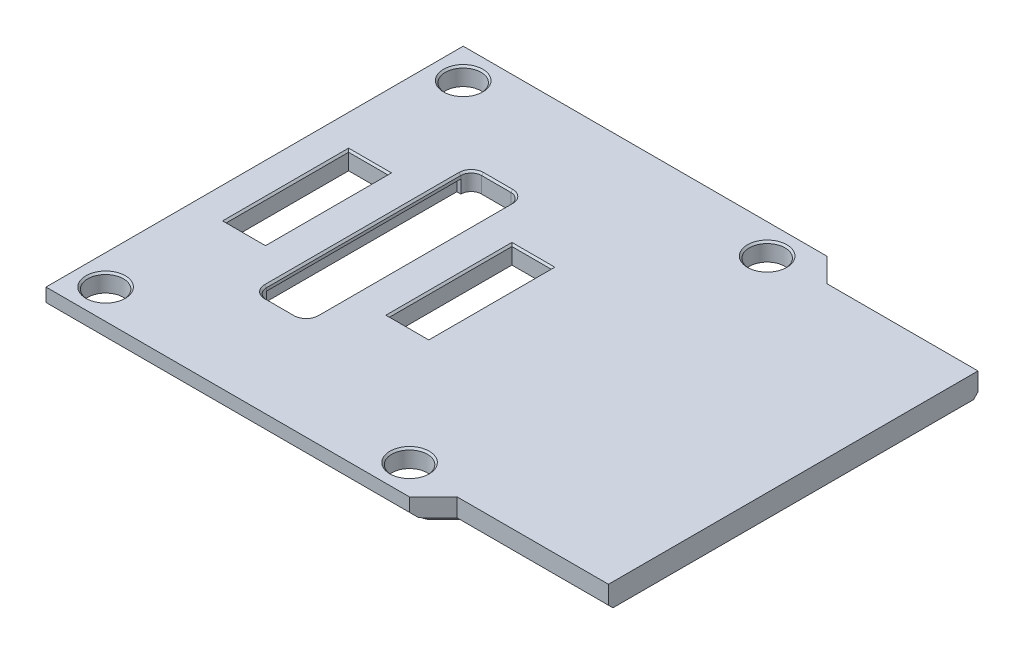
from build123d import *

# Parameters (mm, degrees)
SKETCH21_R          = 3
SKETCH21_W          = 6.6
SKETCH21_H          = 20.55
BOSS_EXTRUDE3_DEPTH = 3
BOSS_EXTRUDE2_DEPTH = 0.8
CUT_EXTRUDE1_DEPTH  = 2.2
CUT_EXTRUDE2_DEPTH  = 1
CHAMFER1_SIZE       = 0.3
CHAMFER2_SIZE       = 0.75


with BuildPart() as part:
    # Sketch21 → Boss-Extrude3 (new body)
    with BuildSketch(Plane(origin=(0, 0, 0), x_dir=(1, 0, 0), z_dir=(0, 1, 0))):
        Polygon((38.5, 35), (-22.5, 35), (-22.5, -35), (38.5, -35), (42.5, -31), (67.875, -31), (67.875, 31), (42.5, 31), align=None)
        with Locations(Location((-17.5, 30, 0), (0, 0, 270))):
            Circle(SKETCH21_R, mode=Mode.SUBTRACT)
        with Locations(Location((-17.5, -30, 0), (0, 0, 270))):
            Circle(SKETCH21_R, mode=Mode.SUBTRACT)
        with Locations(Location((33.5, -30, 0), (0, 0, 270))):
            Circle(SKETCH21_R, mode=Mode.SUBTRACT)
        with Locations(Location((33.5, 30, 0), (0, 0, 270))):
            Circle(SKETCH21_R, mode=Mode.SUBTRACT)
        with Locations((-13.7, 0)):
            Rectangle(SKETCH21_W, SKETCH21_H, mode=Mode.SUBTRACT)
        with BuildLine():
            Line((-4.21, 16.3), (-4.21, -16.3))
            ThreePointArc((-4.21, -16.3), (-3.697436867, -17.537436867), (-2.46, -18.05))
            Line((-2.46, -18.05), (2.46, -18.05))
            ThreePointArc((2.46, -18.05), (3.697436867, -17.537436867), (4.21, -16.3))
            Line((4.21, -16.3), (4.21, 16.3))
            ThreePointArc((4.21, 16.3), (3.697436867, 17.537436867), (2.46, 18.05))
            Line((2.46, 18.05), (-2.46, 18.05))
            ThreePointArc((-2.46, 18.05), (-3.697436867, 17.537436867), (-4.21, 16.3))
        make_face(mode=Mode.SUBTRACT)
        with Locations((13.7, 0)):
            Rectangle(SKETCH21_W, SKETCH21_H, mode=Mode.SUBTRACT)
    extrude(amount=BOSS_EXTRUDE3_DEPTH)

    # Sketch28 → Boss-Extrude2 (add)
    with BuildSketch(Plane.XZ):
        Polygon((39.5, 34), (39.5, -34), (42.5, -31), (67.875, -31), (67.875, 31), (42.5, 31), align=None)
    extrude(amount=BOSS_EXTRUDE2_DEPTH)

    # Sketch29 → Cut-Extrude1 (cut)
    with BuildSketch(Plane.XZ):
        Polygon((-4.21, 16.3), (-4.875, 16.3), (-4.875, -16.3), (-4.21, -16.3), (4.21, -16.3), (4.875, -16.3), (4.875, 16.3), (4.21, 16.3), align=None)
    extrude(amount=-CUT_EXTRUDE1_DEPTH, mode=Mode.SUBTRACT)

    # Sketch30 → Cut-Extrude2 (cut)
    # profile 1 of 4: a face of its own
    with BuildSketch(Plane.XZ):
        Polygon((30, -6.084415584), (30, -7.123376623), (23.194805195, -7.123376623), (30, -9.358766234), (30, -10.290584416), (23.194805195, -12.525974026), (30, -12.525974026), (30, -13.564935065), (22, -13.564935065), (22, -11.939935065), (28.668831169, -9.829545455), (22, -7.709415584), (22, -6.084415584), align=None)
    # profile 2 of 4: a face of its own
    with BuildSketch(Plane.XZ):
        with BuildLine():
            add(Edge.make_bspline(
                [(30.103896104, -2.298701299), (30.103067309, -2.395623244), (30.101458149, -2.583803562), (30.077120757, -2.856806977), (30.043441513, -3.112684332), (29.990720477, -3.349454628), (29.92681865, -3.569556735), (29.84494459, -3.770560491), (29.751676383, -3.9562646), (29.640184851, -4.121871579), (29.516615752, -4.272075178), (29.375879847, -4.401668661), (29.221972567, -4.515692158), (29.052257996, -4.609156913), (28.868514081, -4.686592109), (28.670085387, -4.743928609), (28.457107647, -4.785605452), (28.309709631, -4.797462408), (28.233766234, -4.803571429)],
                knots=[0, 0, 0, 0, 1.318794478, 2.560526035, 3.728243692, 4.829167506, 5.859211314, 6.844017696, 7.77958115, 8.682536498, 9.55583357, 10.420985288, 11.279874663, 12.156984126, 13.05163966, 13.988564904, 14.963654886, 16, 16, 16, 16], degree=3))
            Line((28.233766234, -4.803571429), (28.233766234, -3.76461039))
            add(Edge.make_bspline(
                [(28.233766234, -3.76461039), (28.276082816, -3.763564761), (28.357947694, -3.761541907), (28.476134337, -3.740166384), (28.586751637, -3.712672627), (28.688349357, -3.67036585), (28.783864525, -3.621500377), (28.868666466, -3.555998852), (28.946860594, -3.482137003), (29.015350514, -3.395594265), (29.078413582, -3.299861025), (29.128391442, -3.189971645), (29.17548457, -3.07144951), (29.209220227, -2.940779669), (29.240159157, -2.800318747), (29.257500765, -2.647495072), (29.271994968, -2.484042329), (29.272478757, -2.371250975), (29.272727273, -2.313311688)],
                knots=[0, 0, 0, 0, 1.000573209, 1.935690443, 2.836843993, 3.693268586, 4.535782358, 5.368499125, 6.220215677, 7.076544447, 7.975601122, 8.926814499, 9.928453325, 10.991382637, 12.117004715, 13.331014315, 14.628980654, 16, 16, 16, 16], degree=3))
            add(Edge.make_bspline(
                [(29.272727273, -2.313311688), (29.272477286, -2.261323175), (29.271992064, -2.160413873), (29.25754424, -2.01369465), (29.239472891, -1.876258483), (29.21132631, -1.748275466), (29.176555316, -1.630075024), (29.131923796, -1.521611339), (29.080501402, -1.422166793), (29.001941506, -1.306296479), (28.891278773, -1.182718379), (28.73659228, -1.072587187), (28.562614518, -1.00468464), (28.440535545, -0.997283039), (28.378246753, -0.993506494)],
                knots=[0, 0, 0, 0, 1.049722362, 2.037502948, 2.975957546, 3.848689641, 4.682196446, 5.461765277, 6.214820971, 6.939488855, 8.285974658, 9.541612251, 10.745648019, 12, 12, 12, 12], degree=3))
            add(Edge.make_bspline(
                [(28.378246753, -0.993506494), (28.346763417, -0.994183282), (28.285509435, -0.995500043), (28.198094752, -1.013038493), (28.116989153, -1.036078954), (28.043895516, -1.073277175), (27.978132386, -1.120152847), (27.91781187, -1.175968403), (27.867975971, -1.243948686), (27.822461309, -1.322779364), (27.783044583, -1.418968765), (27.736245211, -1.532239323), (27.690729471, -1.668941517), (27.640192756, -1.826342557), (27.586743359, -2.005529733), (27.52981461, -2.206135721), (27.472099938, -2.429578583), (27.410484723, -2.667825675), (27.348547139, -2.908916775), (27.281606559, -3.138344652), (27.213843382, -3.35068402), (27.144538665, -3.546605107), (27.071027512, -3.724150567), (26.999273376, -3.886230737), (26.921988655, -4.029162978), (26.844897165, -4.158210405), (26.757806858, -4.271639817), (26.655650322, -4.368805026), (26.538272332, -4.449974022), (26.405573224, -4.515399248), (26.259022178, -4.567101625), (26.096859779, -4.604654298), (25.919870357, -4.624614358), (25.797123614, -4.628080852), (25.733766234, -4.62987013)],
                knots=[0, 0, 0, 0, 0.609469888, 1.185784659, 1.72354831, 2.239788445, 2.766795736, 3.28643782, 3.825837257, 4.394650866, 5.047817349, 5.838989728, 6.771546224, 7.840191231, 9.04536596, 10.397473415, 11.883969141, 13.520573579, 15.169980156, 16.710930355, 18.154580726, 19.492276644, 20.739482987, 21.88068629, 22.927624582, 23.888735019, 24.79347993, 25.691627909, 26.611521855, 27.550140283, 28.552530272, 29.619112255, 30.771072804, 32, 32, 32, 32], degree=3))
            add(Edge.make_bspline(
                [(25.733766234, -4.62987013), (25.67520802, -4.627970482), (25.560134212, -4.62423745), (25.391367911, -4.595537471), (25.230466456, -4.550698077), (25.077097455, -4.486528081), (24.932327589, -4.402583067), (24.793763605, -4.302331737), (24.665049855, -4.181655436), (24.543482, -4.046039193), (24.43312437, -3.894260688), (24.339684079, -3.727132066), (24.257615927, -3.549505201), (24.190985373, -3.359321562), (24.141623211, -3.156271887), (24.103560771, -2.942230454), (24.083220864, -2.715216877), (24.079718791, -2.560100694), (24.077922078, -2.480519481)],
                knots=[0, 0, 0, 0, 0.925490325, 1.81869781, 2.698985002, 3.561843198, 4.439506826, 5.339694674, 6.260029024, 7.223537863, 8.216200057, 9.220155366, 10.24621711, 11.306974059, 12.400590692, 13.547020494, 14.741516967, 16, 16, 16, 16], degree=3))
            add(Edge.make_bspline(
                [(24.077922078, -2.480519481), (24.079100785, -2.389033894), (24.081391296, -2.211255453), (24.100967879, -1.95323672), (24.133116756, -1.711952726), (24.17768197, -1.488210503), (24.236413566, -1.281944584), (24.307185153, -1.093035368), (24.392098481, -0.921208329), (24.489260392, -0.766089492), (24.600165531, -0.628414151), (24.72493983, -0.508947344), (24.86185203, -0.405701135), (25.012592849, -0.320870627), (25.17622274, -0.25389912), (25.353001809, -0.206065737), (25.542097394, -0.172474188), (25.673013023, -0.165777509), (25.74025974, -0.162337662)],
                knots=[0, 0, 0, 0, 1.35942475, 2.641688414, 3.842675212, 4.97503988, 6.028837698, 7.026524857, 7.968775207, 8.872346758, 9.741443809, 10.588878301, 11.433254833, 12.283089724, 13.152223979, 14.05361, 15.000208458, 16, 16, 16, 16], degree=3))
            Line((25.74025974, -0.162337662), (25.74025974, -1.201298701))
            add(Edge.make_bspline(
                [(25.74025974, -1.201298701), (25.674721832, -1.208715551), (25.549076856, -1.222934647), (25.375375364, -1.289794963), (25.22801032, -1.391278982), (25.108112126, -1.529254824), (25.017480494, -1.70236831), (24.95378105, -1.908593969), (24.915339674, -2.147931329), (24.911256881, -2.318566714), (24.909090909, -2.409090909)],
                knots=[0, 0, 0, 0, 0.958885329, 1.838312007, 2.683388096, 3.544636038, 4.476874501, 5.512704297, 6.680458674, 8, 8, 8, 8], degree=3))
            add(Edge.make_bspline(
                [(24.909090909, -2.409090909), (24.910895743, -2.490953805), (24.914357274, -2.647960509), (24.950990134, -2.872453696), (25.008423519, -3.075331214), (25.076523787, -3.227354018), (25.141975259, -3.334516311), (25.197828471, -3.402415345), (25.256998255, -3.462751797), (25.325503304, -3.506899846), (25.395422474, -3.546527148), (25.472769579, -3.571306954), (25.554938786, -3.588887883), (25.61190975, -3.590222262), (25.641233766, -3.590909091)],
                knots=[0, 0, 0, 0, 1.898886608, 3.641917703, 5.263913708, 6.781775949, 7.492829293, 8.171637923, 8.820129793, 9.443813489, 10.056392137, 10.680075833, 11.320610447, 12, 12, 12, 12], degree=3))
            add(Edge.make_bspline(
                [(25.641233766, -3.590909091), (25.693601745, -3.588173991), (25.793343993, -3.582964606), (25.932521067, -3.532755637), (26.046460672, -3.446847813), (26.120477608, -3.347186421), (26.16971367, -3.244863761), (26.211505197, -3.142238609), (26.256566207, -3.015362815), (26.304827388, -2.864194696), (26.357408524, -2.688599575), (26.409102043, -2.487553747), (26.469062821, -2.262972788), (26.527292162, -2.019674479), (26.590317686, -1.7725332), (26.656464534, -1.535158817), (26.725715485, -1.314577671), (26.79891335, -1.111735187), (26.873636009, -0.925204125), (26.951004783, -0.755596696), (27.03015641, -0.602152272), (27.113523202, -0.464723076), (27.205414194, -0.342175865), (27.315001132, -0.238929071), (27.438169167, -0.150181539), (27.576625602, -0.076808805), (27.731509238, -0.021618552), (27.901145757, 0.016112898), (28.08529053, 0.041358551), (28.213113542, 0.044058296), (28.279220779, 0.045454545)],
                knots=[0, 0, 0, 0, 0.886876726, 1.689182582, 2.470212093, 3.276978007, 3.770089089, 4.396329915, 5.157818963, 6.055717916, 7.090729244, 8.269771542, 9.580232216, 11.037716353, 12.51750611, 13.910932755, 15.221554488, 16.442288017, 17.571848501, 18.632682187, 19.606715272, 20.501836021, 21.360120455, 22.198499933, 23.047686038, 23.931415603, 24.849906235, 25.830634081, 26.878051879, 28, 28, 28, 28], degree=3))
            add(Edge.make_bspline(
                [(28.279220779, 0.045454545), (28.34371882, 0.043630808), (28.470156379, 0.040055678), (28.655638898, 0.010463378), (28.832279264, -0.040858624), (29.001301578, -0.109714297), (29.160557988, -0.201265786), (29.312612514, -0.310219714), (29.455421384, -0.440819067), (29.587891688, -0.590437305), (29.709455888, -0.755056432), (29.815732766, -0.934994432), (29.904732119, -1.128858396), (29.978152624, -1.336386007), (30.034513409, -1.557599571), (30.074835203, -1.792625486), (30.099493407, -2.041138559), (30.10240589, -2.211522119), (30.103896104, -2.298701299)],
                knots=[0, 0, 0, 0, 0.930697296, 1.824475469, 2.702134557, 3.581182897, 4.452177757, 5.347490549, 6.276448989, 7.239081344, 8.228006388, 9.226020669, 10.250015029, 11.302452558, 12.399371731, 13.540990107, 14.741812496, 16, 16, 16, 16], degree=3))
        make_face()
    # profile 3 of 4: a face of its own
    with BuildSketch(Plane.XZ):
        with BuildLine():
            add(Edge.make_bspline(
                [(25.668831169, 2.030844156), (25.599879149, 2.0955763), (25.465115792, 2.222092118), (25.289146305, 2.429669844), (25.140839124, 2.644866547), (25.017625331, 2.866173219), (24.923131116, 3.095201564), (24.854088133, 3.330607682), (24.812132873, 3.574251525), (24.807523222, 3.739554471), (24.805194805, 3.823051948)],
                knots=[0, 0, 0, 0, 1.105629191, 2.160898297, 3.175754042, 4.158843784, 5.118066112, 6.067548185, 7.023883991, 8, 8, 8, 8], degree=3))
            add(Edge.make_bspline(
                [(24.805194805, 3.823051948), (24.807261899, 3.904350467), (24.811318594, 4.063899683), (24.846822964, 4.298305364), (24.902887412, 4.522704156), (24.983515789, 4.737553841), (25.0864661, 4.942212137), (25.209630703, 5.138960045), (25.35994633, 5.322621608), (25.528384915, 5.497105626), (25.716326951, 5.654707301), (25.915776909, 5.795517975), (26.129165136, 5.913571811), (26.35481038, 6.008554801), (26.592658677, 6.084284067), (26.842718688, 6.137509016), (27.105295373, 6.168215197), (27.284011049, 6.172926185), (27.375, 6.175324675)],
                knots=[0, 0, 0, 0, 1.002345734, 1.967114251, 2.917434677, 3.851034004, 4.791362191, 5.739499939, 6.707956071, 7.713408622, 8.727048188, 9.728860357, 10.720817187, 11.7287704, 12.744188648, 13.795481033, 14.87762018, 16, 16, 16, 16], degree=3))
            add(Edge.make_bspline(
                [(27.375, 6.175324675), (27.468142363, 6.172893926), (27.651152463, 6.168117885), (27.92032099, 6.137843758), (28.178246688, 6.082648603), (28.427017824, 6.011573201), (28.663858155, 5.913962765), (28.890314083, 5.79735916), (29.10550512, 5.657942778), (29.30912237, 5.500438279), (29.494870843, 5.324542416), (29.659220969, 5.134119067), (29.795817562, 4.927874268), (29.909411725, 4.708300037), (29.996766602, 4.474412144), (30.058329247, 4.226589068), (30.096543557, 3.96547265), (30.101408276, 3.786388997), (30.103896104, 3.694805195)],
                knots=[0, 0, 0, 0, 1.082792019, 2.12751609, 3.142796731, 4.145943708, 5.130619929, 6.115276059, 7.102821044, 8.106874758, 9.103532392, 10.07165553, 11.024184519, 11.972237754, 12.939604537, 13.919023097, 14.935783512, 16, 16, 16, 16], degree=3))
            add(Edge.make_bspline(
                [(30.103896104, 3.694805195), (30.100666259, 3.590207337), (30.094375464, 3.386481285), (30.048576327, 3.089318155), (29.970457334, 2.810344626), (29.861744642, 2.54858937), (29.719797872, 2.30604671), (29.549118669, 2.07987546), (29.34299531, 1.875532144), (29.110855257, 1.686134953), (28.848042939, 1.518917981), (28.556920482, 1.374855845), (28.239510845, 1.250731984), (27.893790289, 1.153417235), (27.522233838, 1.075678167), (27.123780529, 1.01881412), (26.698029371, 0.987185679), (26.40535435, 0.982783131), (26.25487013, 0.980519481)],
                knots=[0, 0, 0, 0, 0.944154094, 1.838936197, 2.706634319, 3.554071019, 4.390323081, 5.237478091, 6.104570855, 7.00414148, 7.937886347, 8.910137351, 9.932595178, 11.010329603, 12.148625872, 13.357709771, 14.641418112, 16, 16, 16, 16], degree=3))
            add(Edge.make_bspline(
                [(26.25487013, 0.980519481), (26.078954349, 0.982711011), (25.738172169, 0.986956421), (25.243959532, 1.019229867), (24.783156858, 1.073579973), (24.356336771, 1.150752456), (23.963410269, 1.249335219), (23.604326441, 1.368439564), (23.279001374, 1.511516263), (22.987279665, 1.676503513), (22.729173458, 1.864068723), (22.506320061, 2.075493449), (22.316048111, 2.308241051), (22.162895813, 2.564909046), (22.040535866, 2.841343734), (21.957978479, 3.141751493), (21.903809526, 3.462863168), (21.898716581, 3.684831426), (21.896103896, 3.798701299)],
                knots=[0, 0, 0, 0, 1.437068444, 2.783873704, 4.043935084, 5.225790597, 6.324782884, 7.350886107, 8.312787249, 9.223552911, 10.083880732, 10.912539479, 11.72654107, 12.53169554, 13.34728014, 14.188298876, 15.070596049, 16, 16, 16, 16], degree=3))
            add(Edge.make_bspline(
                [(21.896103896, 3.798701299), (21.897757372, 3.871809662), (21.901011194, 4.01567722), (21.923898696, 4.227457697), (21.962632326, 4.431167604), (22.01801299, 4.625996505), (22.087765803, 4.811872972), (22.173172734, 4.988896422), (22.273342563, 5.157949988), (22.390812362, 5.316695031), (22.521248267, 5.465764962), (22.671186645, 5.597017829), (22.83324007, 5.716480207), (23.011455278, 5.818930876), (23.204750618, 5.905246802), (23.413030938, 5.976049929), (23.636069603, 6.033507204), (23.790881241, 6.058589073), (23.87012987, 6.071428571)],
                knots=[0, 0, 0, 0, 1.054376135, 2.074872325, 3.068297232, 4.041746001, 4.99268845, 5.928228303, 6.873226801, 7.822341838, 8.773188195, 9.724034551, 10.690354722, 11.672959262, 12.682563207, 13.738959498, 14.842565305, 16, 16, 16, 16], degree=3))
            Line((23.87012987, 6.071428571), (23.87012987, 5.032467532))
            add(Edge.make_bspline(
                [(23.87012987, 5.032467532), (23.780217637, 5.018496413), (23.609174942, 4.991918739), (23.373302943, 4.910034601), (23.172274694, 4.797564545), (23.006664077, 4.651659374), (22.879515501, 4.47180865), (22.790084299, 4.260968508), (22.735985184, 4.019464835), (22.730277301, 3.848245208), (22.727272727, 3.758116883)],
                knots=[0, 0, 0, 0, 1.139946848, 2.168554526, 3.114336709, 4.013719482, 4.91433169, 5.854049851, 6.870392973, 8, 8, 8, 8], degree=3))
            add(Edge.make_bspline(
                [(22.727272727, 3.758116883), (22.729232858, 3.697865304), (22.733083673, 3.579496833), (22.770303595, 3.406581689), (22.830720882, 3.243299288), (22.914679895, 3.088391823), (23.023472478, 2.943611318), (23.15409375, 2.806020895), (23.310496032, 2.679481968), (23.488710679, 2.561395838), (23.690261061, 2.45434826), (23.91164813, 2.357745068), (24.15402159, 2.272464701), (24.417282405, 2.202988331), (24.700886201, 2.140497164), (25.004910521, 2.090985593), (25.329977038, 2.053474108), (25.553490293, 2.038547053), (25.668831169, 2.030844156)],
                knots=[0, 0, 0, 0, 0.770270573, 1.513250793, 2.251698234, 2.992350776, 3.759720366, 4.563091912, 5.414379532, 6.328692104, 7.295429819, 8.331243736, 9.417660894, 10.580257233, 11.813717164, 13.133315251, 14.520687607, 16, 16, 16, 16], degree=3))
        make_face()
        with BuildLine():
            add(Edge.make_bspline(
                [(26.480519481, 2.019480519), (26.589886748, 2.022074166), (26.801887213, 2.02710176), (27.11008964, 2.054067469), (27.398500142, 2.09197872), (27.667932285, 2.144046445), (27.917642032, 2.208183189), (28.148280784, 2.285672727), (28.358346258, 2.378446802), (28.548852399, 2.48348096), (28.718160616, 2.600826901), (28.867455984, 2.726465492), (28.991166543, 2.864778093), (29.096421254, 3.009540951), (29.173548373, 3.167354192), (29.231272272, 3.332256382), (29.266649447, 3.507166576), (29.2706701, 3.62699916), (29.272727273, 3.688311688)],
                knots=[0, 0, 0, 0, 1.452425334, 2.815420487, 4.106086934, 5.313854542, 6.457205032, 7.527519891, 8.540962664, 9.502747939, 10.411701781, 11.272962527, 12.086971166, 12.870532083, 13.641804993, 14.409924772, 15.186435533, 16, 16, 16, 16], degree=3))
            add(Edge.make_bspline(
                [(29.272727273, 3.688311688), (29.271259496, 3.741988664), (29.268382236, 3.84721078), (29.243077085, 4.000696142), (29.203705611, 4.14642846), (29.142954857, 4.281958561), (29.071273707, 4.411858532), (28.977703963, 4.529980345), (28.872868712, 4.643879736), (28.748654376, 4.744107243), (28.615121172, 4.83681877), (28.471062909, 4.916134841), (28.319978563, 4.985046023), (28.159856994, 5.039677086), (27.992376986, 5.084027372), (27.816403285, 5.114541784), (27.632406218, 5.132383409), (27.507074414, 5.135019692), (27.443181818, 5.136363636)],
                knots=[0, 0, 0, 0, 0.985968178, 1.932777627, 2.852286581, 3.752165049, 4.656485222, 5.571626193, 6.514509019, 7.496404905, 8.497904232, 9.499749252, 10.514740863, 11.546505536, 12.605619624, 13.696349128, 14.825627413, 16, 16, 16, 16], degree=3))
            add(Edge.make_bspline(
                [(27.443181818, 5.136363636), (27.378759708, 5.134958086), (27.25237066, 5.132200551), (27.067032216, 5.115262174), (26.891466474, 5.081964668), (26.724007417, 5.038418195), (26.565667562, 4.981399689), (26.414540327, 4.914026079), (26.275148876, 4.829546939), (26.143219918, 4.736974161), (26.026037916, 4.631027546), (25.919421799, 4.519044686), (25.832811286, 4.395064451), (25.759670187, 4.263878528), (25.704906917, 4.123892214), (25.66574665, 3.975186899), (25.640825202, 3.818478879), (25.637865532, 3.710591844), (25.636363636, 3.655844156)],
                knots=[0, 0, 0, 0, 1.179584867, 2.314214918, 3.402349685, 4.447654924, 5.478589723, 6.480508191, 7.471047851, 8.458014051, 9.426357996, 10.358710936, 11.282338492, 12.186853705, 13.103012739, 14.025789809, 14.998179494, 16, 16, 16, 16], degree=3))
            add(Edge.make_bspline(
                [(25.636363636, 3.655844156), (25.638631124, 3.585809023), (25.643169423, 3.445636117), (25.687678162, 3.236992259), (25.750820382, 3.028526653), (25.846314012, 2.822859157), (25.964098934, 2.617251027), (26.11373052, 2.416518374), (26.282408521, 2.21172563), (26.413187709, 2.084818671), (26.480519481, 2.019480519)],
                knots=[0, 0, 0, 0, 0.88646451, 1.774228181, 2.694002459, 3.642505734, 4.641256791, 5.692129621, 6.811791056, 8, 8, 8, 8], degree=3))
        make_face(mode=Mode.SUBTRACT)
    # profile 4 of 4: a face of its own
    with BuildSketch(Plane.XZ):
        with BuildLine():
            add(Edge.make_bspline(
                [(24.878246753, 8.461038961), (24.814187466, 8.518718223), (24.688796852, 8.631620481), (24.52623408, 8.819626512), (24.38902696, 9.016006238), (24.274055052, 9.219122635), (24.185259096, 9.432124103), (24.124260188, 9.654220452), (24.085370567, 9.885004196), (24.080429628, 10.042051167), (24.077922078, 10.121753247)],
                knots=[0, 0, 0, 0, 1.085250411, 2.124285525, 3.122966424, 4.099740098, 5.059495047, 6.022248179, 6.996281616, 8, 8, 8, 8], degree=3))
            add(Edge.make_bspline(
                [(24.077922078, 10.121753247), (24.080388406, 10.21442069), (24.085197844, 10.395125927), (24.123411532, 10.657861469), (24.184306732, 10.904870872), (24.272255, 11.135752436), (24.387153957, 11.349110858), (24.524114245, 11.548005833), (24.688142408, 11.729328525), (24.877058745, 11.892596956), (25.086654972, 12.038797969), (25.315305287, 12.164833525), (25.559504609, 12.274982728), (25.822560693, 12.361856011), (26.102716801, 12.430025074), (26.400708473, 12.478028939), (26.715845271, 12.507721006), (26.931750621, 12.511204737), (27.042207792, 12.512987013)],
                knots=[0, 0, 0, 0, 1.032558834, 2.013531219, 2.952724632, 3.863440268, 4.759334089, 5.647806176, 6.548963813, 7.476698465, 8.425450168, 9.392113565, 10.383030705, 11.407311388, 12.475256329, 13.593801989, 14.76898917, 16, 16, 16, 16], degree=3))
            add(Edge.make_bspline(
                [(27.042207792, 12.512987013), (27.157541132, 12.510763865), (27.382188592, 12.506433594), (27.709535495, 12.474051549), (28.017782216, 12.418849126), (28.307815796, 12.342667109), (28.580203904, 12.246008442), (28.833597649, 12.125035021), (29.068200596, 11.982093506), (29.282094588, 11.81769338), (29.474911402, 11.638602071), (29.643383348, 11.446244921), (29.785901829, 11.242265117), (29.901915152, 11.025799081), (29.993700364, 10.798532687), (30.0563313, 10.558394628), (30.096796644, 10.308192264), (30.101508048, 10.137064002), (30.103896104, 10.050324675)],
                knots=[0, 0, 0, 0, 1.255961248, 2.446374192, 3.578096896, 4.663065679, 5.708848904, 6.721082169, 7.715645011, 8.695165174, 9.654207175, 10.577283402, 11.474815653, 12.358130333, 13.246756847, 14.137354944, 15.05588606, 16, 16, 16, 16], degree=3))
            add(Edge.make_bspline(
                [(30.103896104, 10.050324675), (30.101957507, 9.973402044), (30.098135909, 9.821762811), (30.06994442, 9.59904847), (30.024642656, 9.385538268), (29.961678515, 9.181233999), (29.877748249, 8.987089156), (29.776994728, 8.801656094), (29.658183542, 8.624227831), (29.565007665, 8.515871412), (29.517857143, 8.461038961)],
                knots=[0, 0, 0, 0, 1.064402764, 2.098279994, 3.101513528, 4.082158303, 5.051759688, 6.023614418, 6.999874063, 8, 8, 8, 8], degree=3))
            Line((29.517857143, 8.461038961), (32.285714286, 8.461038961))
            Line((32.285714286, 8.461038961), (32.285714286, 7.422077922))
            Line((32.285714286, 7.422077922), (24.181818182, 7.422077922))
            Line((24.181818182, 7.422077922), (24.181818182, 8.461038961))
            Line((24.181818182, 8.461038961), (24.878246753, 8.461038961))
        make_face()
        with BuildLine():
            add(Edge.make_bspline(
                [(28.582792208, 8.461038961), (28.638068094, 8.516806457), (28.746272219, 8.625972921), (28.88604868, 8.80468271), (29.005525826, 8.988624463), (29.10353432, 9.178758798), (29.178838914, 9.375397967), (29.232421931, 9.577816102), (29.266023104, 9.786763726), (29.270477616, 9.928446258), (29.272727273, 10)],
                knots=[0, 0, 0, 0, 1.085707992, 2.125304366, 3.132607823, 4.117140125, 5.079411284, 6.040195589, 7.010242569, 8, 8, 8, 8], degree=3))
            add(Edge.make_bspline(
                [(29.272727273, 10), (29.271564887, 10.055333141), (29.269292802, 10.163491349), (29.239839848, 10.320741082), (29.196497459, 10.46900301), (29.136257851, 10.609490038), (29.055236931, 10.73925618), (28.959450301, 10.86231131), (28.844022134, 10.974748696), (28.712202831, 11.078371652), (28.563994598, 11.173419787), (28.397122683, 11.254505361), (28.212848364, 11.321562178), (28.013017105, 11.379403423), (27.794752168, 11.419663171), (27.5604292, 11.453303498), (27.308137994, 11.469921857), (27.134757703, 11.472630718), (27.045454545, 11.474025974)],
                knots=[0, 0, 0, 0, 0.883090077, 1.726152498, 2.546968976, 3.348612605, 4.159853212, 4.985030933, 5.834983544, 6.727674538, 7.660828743, 8.643132597, 9.685597177, 10.791445765, 11.963314957, 13.229053737, 14.572765964, 16, 16, 16, 16], degree=3))
            add(Edge.make_bspline(
                [(27.045454545, 11.474025974), (26.960488256, 11.472475312), (26.795809545, 11.469469872), (26.556459939, 11.455037872), (26.334057605, 11.422691005), (26.126274149, 11.383838663), (25.935303572, 11.329227501), (25.757782142, 11.267878791), (25.598800519, 11.188161553), (25.452904693, 11.101577669), (25.325039242, 11.002172732), (25.21216834, 10.89471845), (25.119935221, 10.774953005), (25.042443311, 10.64727479), (24.981985433, 10.510401495), (24.939903278, 10.363480785), (24.913104526, 10.207694614), (24.91044575, 10.100220469), (24.909090909, 10.045454545)],
                knots=[0, 0, 0, 0, 1.408584611, 2.730069766, 3.970578609, 5.131496849, 6.230442265, 7.260312358, 8.239039861, 9.17271741, 10.067908288, 10.917833178, 11.748516327, 12.565283383, 13.388525032, 14.22012764, 15.093025089, 16, 16, 16, 16], degree=3))
            add(Edge.make_bspline(
                [(24.909090909, 10.045454545), (24.911597622, 9.973740048), (24.91662789, 9.829829249), (24.967176055, 9.618412528), (25.041627812, 9.410177473), (25.150533213, 9.209114776), (25.288800898, 9.011868337), (25.4585467, 8.821890573), (25.656752375, 8.634221833), (25.805680198, 8.520282822), (25.883116883, 8.461038961)],
                knots=[0, 0, 0, 0, 0.889314606, 1.784603949, 2.686204335, 3.630395475, 4.614970347, 5.672211878, 6.789640565, 8, 8, 8, 8], degree=3))
            Line((25.883116883, 8.461038961), (28.582792208, 8.461038961))
        make_face(mode=Mode.SUBTRACT)
    extrude(amount=-CUT_EXTRUDE2_DEPTH, mode=Mode.SUBTRACT)

    # Chamfer1
    chamfer1_edges = [part.edges().sort_by_distance(p)[0] for p in [
        (-17.5, 3, -33),
        (-17.5, 3, 27),
        (33.5, 3, 27),
        (33.5, 3, -33),
        (-13.7, 3, 10.275),
        (-10.4, 3, 0),
        (-13.7, 3, -10.275),
        (-17, 3, 0),
        (-3.697436867, 3, -17.537436867),
        (-4.21, 3, 0),
        (-3.697436867, 3, 17.537436867),
        (0, 3, 18.05),
        (3.697436867, 3, 17.537436867),
        (4.21, 3, 0),
        (3.697436867, 3, -17.537436867),
        (0, 3, -18.05),
        (17, 3, 0),
        (13.7, 3, -10.275),
        (10.4, 3, 0),
        (13.7, 3, 10.275),
    ]]
    chamfer(chamfer1_edges, length=CHAMFER1_SIZE)

    # Chamfer2
    chamfer2_edges = [part.edges().sort_by_distance(p)[0] for p in [
        (8, 0, 35),
        (-22.5, 0, 0),
        (41, -0.8, -32.5),
        (55.1875, -0.8, -31),
        (55.1875, -0.8, 31),
        (41, -0.8, 32.5),
        (8, 0, -35),
    ]]
    chamfer(chamfer2_edges, length=CHAMFER2_SIZE)


solid = part.part
